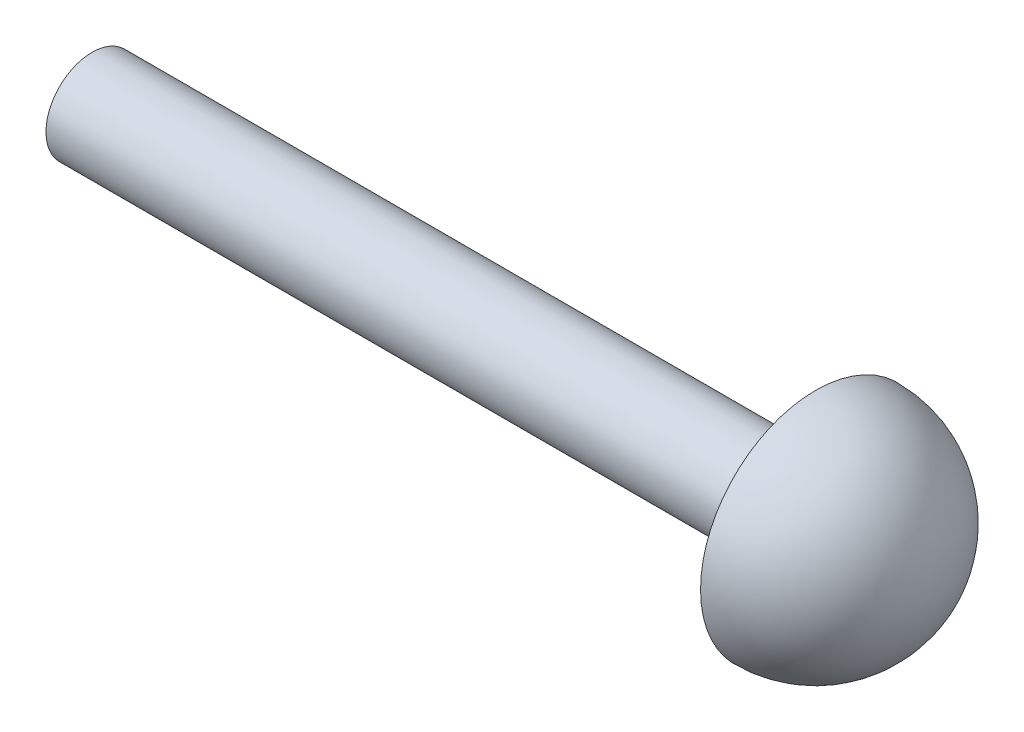
from build123d import *


with BuildPart() as part:
    # Sketch1 → Revolve1 (revolve)
    with BuildSketch(Plane.XY):
        with BuildLine():
            Line((0, 5), (0, 2))
            Line((0, 2), (-31.449781659, 2))
            Line((-31.449781659, 2), (-31.449781659, 0))
            Line((-31.449781659, 0), (0, 0))
            Line((0, 0), (5, 0))
            ThreePointArc((5, 0), (3.535533906, 3.535533906), (0, 5))
        make_face()
    revolve(axis=Axis((-31.449781659, 0, 0), (1, 0, 0)))


solid = part.part
